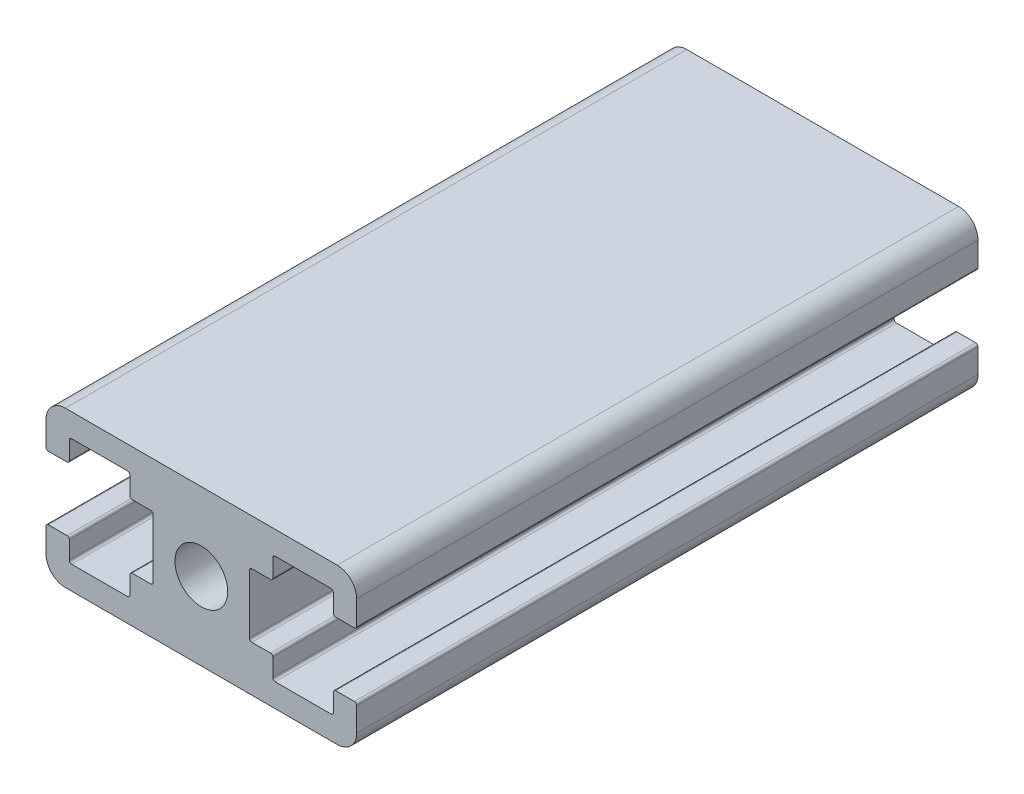
from build123d import *

# Parameters (mm, degrees)
SKETCH_1_R      = 3.4
EXTRUDE_1_DEPTH = 80


with BuildPart() as part:
    # 草图1 → 凸台-拉伸1 (new body)
    with BuildSketch(Plane.XY):
        with BuildLine():
            Line((20.229808423, 4.055287365), (20.229808423, 7.155287365))
            ThreePointArc((20.229808423, 7.155287365), (19.497575376, 8.923054318), (17.729808423, 9.655287365))
            Line((17.729808423, 9.655287365), (-17.270191577, 9.655287365))
            ThreePointArc((-17.270191577, 9.655287365), (-19.03795853, 8.923054318), (-19.770191577, 7.155287365))
            Line((-19.770191577, 7.155287365), (-19.770191577, 4.055287365))
            ThreePointArc((-19.770191577, 4.055287365), (-19.682323611, 3.843155331), (-19.470191577, 3.755287365))
            Line((-19.470191577, 3.755287365), (-17.070191577, 3.755287365))
            ThreePointArc((-17.070191577, 3.755287365), (-16.858059542, 3.843155331), (-16.770191577, 4.055287365))
            Line((-16.770191577, 4.055287365), (-16.770191577, 6.355287365))
            ThreePointArc((-16.770191577, 6.355287365), (-16.682323611, 6.567419399), (-16.470191577, 6.655287365))
            Line((-16.470191577, 6.655287365), (-9.270191577, 6.655287365))
            ThreePointArc((-9.270191577, 6.655287365), (-9.058059542, 6.567419399), (-8.970191577, 6.355287365))
            Line((-8.970191577, 6.355287365), (-8.970191577, 4.055287365))
            ThreePointArc((-8.970191577, 4.055287365), (-8.882323611, 3.843155331), (-8.670191577, 3.755287365))
            Line((-8.670191577, 3.755287365), (-6.270191577, 3.755287365))
            ThreePointArc((-6.270191577, 3.755287365), (-6.058059542, 3.667419399), (-5.970191577, 3.455287365))
            Line((-5.970191577, 3.455287365), (-5.970191577, -4.144712635))
            ThreePointArc((-5.970191577, -4.144712635), (-6.058059542, -4.356844669), (-6.270191577, -4.444712635))
            Line((-6.270191577, -4.444712635), (-8.670191577, -4.444712635))
            ThreePointArc((-8.670191577, -4.444712635), (-8.882323611, -4.532580601), (-8.970191577, -4.744712635))
            Line((-8.970191577, -4.744712635), (-8.970191577, -7.044712635))
            ThreePointArc((-8.970191577, -7.044712635), (-9.058059542, -7.256844669), (-9.270191577, -7.344712635))
            Line((-9.270191577, -7.344712635), (-16.470191577, -7.344712635))
            ThreePointArc((-16.470191577, -7.344712635), (-16.682323611, -7.256844669), (-16.770191577, -7.044712635))
            Line((-16.770191577, -7.044712635), (-16.770191577, -4.744712635))
            ThreePointArc((-16.770191577, -4.744712635), (-16.858059542, -4.532580601), (-17.070191577, -4.444712635))
            Line((-17.070191577, -4.444712635), (-19.470191577, -4.444712635))
            ThreePointArc((-19.470191577, -4.444712635), (-19.682323611, -4.532580601), (-19.770191577, -4.744712635))
            Line((-19.770191577, -4.744712635), (-19.770191577, -7.844712635))
            ThreePointArc((-19.770191577, -7.844712635), (-19.03795853, -9.612479588), (-17.270191577, -10.344712635))
            Line((-17.270191577, -10.344712635), (17.729808423, -10.344712635))
            ThreePointArc((17.729808423, -10.344712635), (19.497575376, -9.612479588), (20.229808423, -7.844712635))
            Line((20.229808423, -7.844712635), (20.229808423, -4.744712635))
            ThreePointArc((20.229808423, -4.744712635), (20.141940458, -4.532580601), (19.929808423, -4.444712635))
            Line((19.929808423, -4.444712635), (17.529808423, -4.444712635))
            ThreePointArc((17.529808423, -4.444712635), (17.317676389, -4.532580601), (17.229808423, -4.744712635))
            Line((17.229808423, -4.744712635), (17.229808423, -7.044712635))
            ThreePointArc((17.229808423, -7.044712635), (17.141940458, -7.256844669), (16.929808423, -7.344712635))
            Line((16.929808423, -7.344712635), (9.729808423, -7.344712635))
            ThreePointArc((9.729808423, -7.344712635), (9.517676389, -7.256844669), (9.429808423, -7.044712635))
            Line((9.429808423, -7.044712635), (9.429808423, -4.744712635))
            ThreePointArc((9.429808423, -4.744712635), (9.341940458, -4.532580601), (9.129808423, -4.444712635))
            Line((9.129808423, -4.444712635), (6.729808423, -4.444712635))
            ThreePointArc((6.729808423, -4.444712635), (6.517676389, -4.356844669), (6.429808423, -4.144712635))
            Line((6.429808423, -4.144712635), (6.429808423, 3.455287365))
            ThreePointArc((6.429808423, 3.455287365), (6.517676389, 3.667419399), (6.729808423, 3.755287365))
            Line((6.729808423, 3.755287365), (9.129808423, 3.755287365))
            ThreePointArc((9.129808423, 3.755287365), (9.341940458, 3.843155331), (9.429808423, 4.055287365))
            Line((9.429808423, 4.055287365), (9.429808423, 6.355287365))
            ThreePointArc((9.429808423, 6.355287365), (9.517676389, 6.567419399), (9.729808423, 6.655287365))
            Line((9.729808423, 6.655287365), (16.929808423, 6.655287365))
            ThreePointArc((16.929808423, 6.655287365), (17.141940458, 6.567419399), (17.229808423, 6.355287365))
            Line((17.229808423, 6.355287365), (17.229808423, 4.055287365))
            ThreePointArc((17.229808423, 4.055287365), (17.317676389, 3.843155331), (17.529808423, 3.755287365))
            Line((17.529808423, 3.755287365), (19.929808423, 3.755287365))
            ThreePointArc((19.929808423, 3.755287365), (20.141940458, 3.843155331), (20.229808423, 4.055287365))
        make_face()
        with Locations((0.229808423, -0.344712635)):
            Circle(SKETCH_1_R, mode=Mode.SUBTRACT)
    extrude(amount=EXTRUDE_1_DEPTH)


solid = part.part
